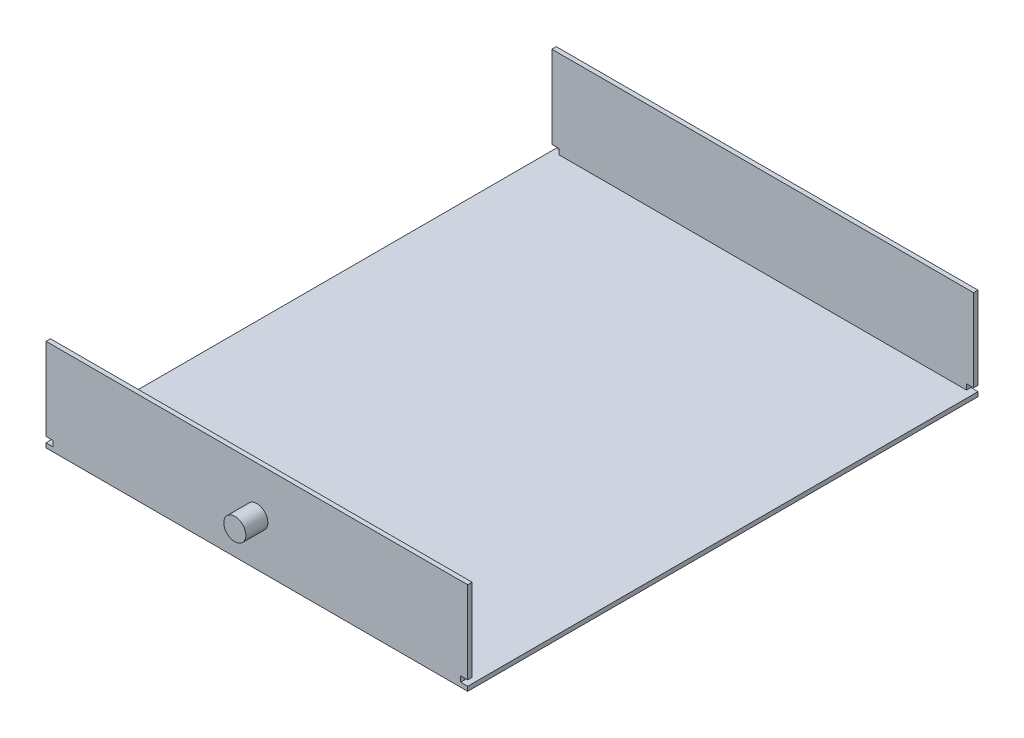
from build123d import *

# Parameters (mm, degrees)
SKETCH_2_W      = 191.4
SKETCH_2_H      = 231.6
EXTRUDE_1_DEPTH = 2
SKETCH_3_W      = 185
SKETCH_3_H      = 2
EXTRUDE_2_DEPTH = 2.5
SKETCH_4_W      = 191.4
SKETCH_4_H      = 2
EXTRUDE_3_DEPTH = 37.4
SKETCH_7_R      = 5
EXTRUDE_5_DEPTH = 10


with BuildPart() as part:
    # 草图2 → 凸台-拉伸1 (new body)
    with BuildSketch(Plane(origin=(0, 0, 0), x_dir=(1, 0, 0), z_dir=(0, 1, 0))):
        Rectangle(SKETCH_2_W, SKETCH_2_H)
    extrude(amount=EXTRUDE_1_DEPTH)

    # 草图3 → 凸台-拉伸2 (add)
    with BuildSketch(Plane(origin=(0, 2, 0), x_dir=(1, 0, 0), z_dir=(0, 1, 0))):
        with Locations((0, 114.8)):
            Rectangle(SKETCH_3_W, SKETCH_3_H)
        with Locations((0, -114.8)):
            Rectangle(SKETCH_3_W, SKETCH_3_H)
    extrude(amount=EXTRUDE_2_DEPTH)

    # 草图4 → 凸台-拉伸3 (add)
    with BuildSketch(Plane(origin=(0, 4.5, 0), x_dir=(1, 0, 0), z_dir=(0, 1, 0))):
        with Locations((0, 114.8)):
            Rectangle(SKETCH_4_W, SKETCH_4_H)
        with Locations((0, -114.8)):
            Rectangle(SKETCH_4_W, SKETCH_4_H)
    extrude(amount=EXTRUDE_3_DEPTH)

    # 草图7 → 凸台-拉伸5 (add)
    with BuildSketch(Plane.XY.offset(115.8)):
        with Locations(Location((0, 20.95, 0), (0, 0, 180))):
            Circle(SKETCH_7_R)
    extrude(amount=EXTRUDE_5_DEPTH)


solid = part.part
